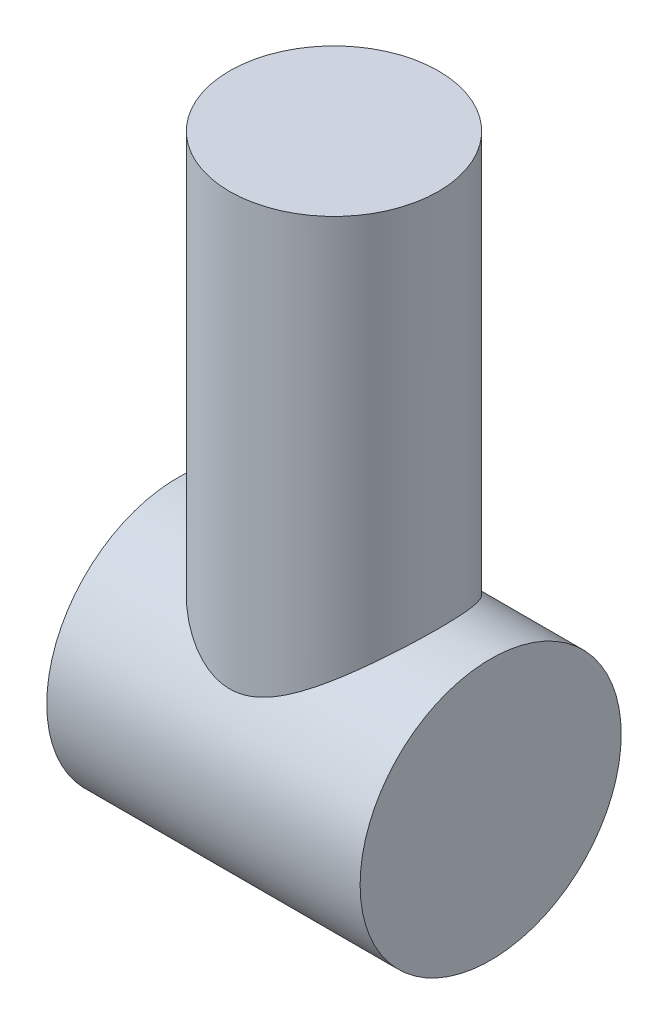
from build123d import *

# Parameters (mm, degrees)
SKETCH_2_R      = 50
EXTRUDE_1_DEPTH = 60
SKETCH_3_R      = 40
EXTRUDE_2_DEPTH = 195


with BuildPart() as part:
    # 草图2 → 凸台-拉伸1 (new, symmetric)
    with BuildSketch(Plane(origin=(0, 0, 0), x_dir=(0, 0, -1), z_dir=(1, 0, 0))):
        Circle(SKETCH_2_R)
    extrude(amount=EXTRUDE_1_DEPTH, both=True)

    # 草图3 → 凸台-拉伸2 (add)
    with BuildSketch(Plane(origin=(0, 0, 0), x_dir=(1, 0, 0), z_dir=(0, 1, 0))):
        with Locations(Location((0, 0, 0), (0, 0, 90))):
            Circle(SKETCH_3_R)
    extrude(amount=EXTRUDE_2_DEPTH)


solid = part.part
